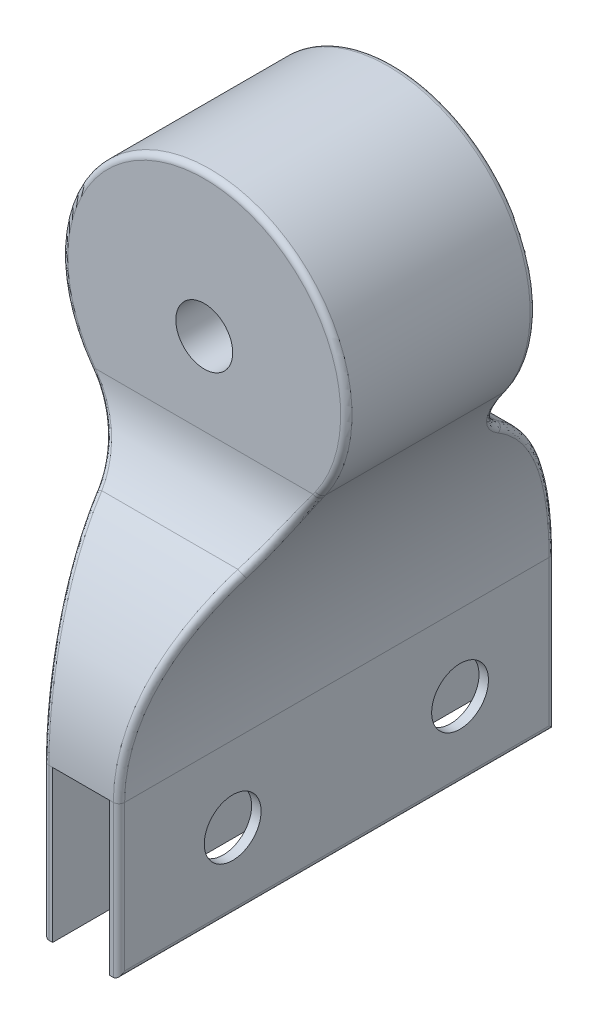
from build123d import *

# Parameters (mm, degrees)
BOSS_EXTRUDE1_DEPTH     = 23
CUT_EXTRUDE2_DEPTH      = 23
CUT_EXTRUDE2_DEPTH_BACK = 23
SKETCH2_OUTSIDE_W       = 32.388
SKETCH2_OUTSIDE_H       = 34.095
SKETCH3_W               = 0.5
SKETCH3_H               = 23
BOSS_EXTRUDE4_DEPTH     = 8
SKETCH4_R               = 1.5
CUT_EXTRUDE3_DEPTH      = 6
SKETCH5_R               = 1.5
CUT_EXTRUDE4_DEPTH      = 16
FILLET5_R               = 0.3


with BuildPart() as part:
    # Sketch1 → Boss-Extrude1 (new body)
    with BuildSketch(Plane.XY):
        with BuildLine():
            Line((-2, -17.207072189), (2, -17.207072189))
            ThreePointArc((2, -17.207072189), (3.052368374, -10.458182005), (6.109550562, -4.35010252))
            ThreePointArc((6.109550562, -4.35010252), (0, 7.5), (-6.109550562, -4.35010252))
            ThreePointArc((-6.109550562, -4.35010252), (-3.052368374, -10.458182005), (-2, -17.207072189))
        make_face()
    extrude(amount=BOSS_EXTRUDE1_DEPTH)

    # Sketch2 outside → Cut-Extrude2 (cut, two sides: drawn at the far end of the back side and taken through both)
    with BuildSketch(Plane(origin=(0, 0, 0), x_dir=(0, 0, -1), z_dir=(1, 0, 0)).offset(-CUT_EXTRUDE2_DEPTH_BACK)):
        with Locations((-11.5, -4.8535)):
            Rectangle(SKETCH2_OUTSIDE_W, SKETCH2_OUTSIDE_H)
        with BuildLine():
            Line((-16.5, 7.5), (-6.5, 7.5))
            Line((-6.5, 7.5), (-6.5, -4.35010252))
            ThreePointArc((-6.5, -4.35010252), (-6.019657091, -6.364854541), (-4.681966685, -7.946163934))
            ThreePointArc((-4.681966685, -7.946163934), (-11.5, -28.707072189), (-18.318033315, -7.946163934))
            ThreePointArc((-18.318033315, -7.946163934), (-16.980342909, -6.364854541), (-16.5, -4.35010252))
            Line((-16.5, -4.35010252), (-16.5, 7.5))
        make_face(mode=Mode.SUBTRACT)
    extrude(amount=CUT_EXTRUDE2_DEPTH + CUT_EXTRUDE2_DEPTH_BACK, mode=Mode.SUBTRACT)

    # Sketch3 → Boss-Extrude4 (add)
    with BuildSketch(Plane.XZ.offset(17.207072189)):
        with Locations((-1.75, 11.5)):
            Rectangle(SKETCH3_W, SKETCH3_H)
        with Locations((1.75, 11.5)):
            Rectangle(SKETCH3_W, SKETCH3_H)
    extrude(amount=BOSS_EXTRUDE4_DEPTH)

    # Sketch4 → Cut-Extrude3 (cut)
    with BuildSketch(Plane.ZY.offset(2)):
        with Locations((17, -21.207072189)):
            Circle(SKETCH4_R)
        with Locations((5, -21.207072189)):
            Circle(SKETCH4_R)
    extrude(amount=-CUT_EXTRUDE3_DEPTH, mode=Mode.SUBTRACT)

    # Sketch5 → Cut-Extrude4 (cut)
    with BuildSketch(Plane.XY.offset(16.5)):
        Circle(SKETCH5_R)
    extrude(amount=-CUT_EXTRUDE4_DEPTH, mode=Mode.SUBTRACT)

    # Fillet5
    fillet5_edges = [part.edges().sort_by_distance(p)[0] for p in [
        (4.879540426, -6.281511676, 6.060709176),
        (2.630286808, -11.958695915, 1.267476013),
        (2.630286808, -11.958695916, 21.732523986),
        (4.879540426, -6.281511676, 16.939290824),
        (0, 7.5, 6.5),
        (0, 7.5, 16.5),
        (-2.630286808, -11.958695915, 1.267476013),
        (-4.879540426, -6.281511676, 6.060709176),
        (-4.879540426, -6.281511676, 16.939290824),
        (-2.630286808, -11.958695916, 21.732523986),
        (2, -21.207072189, 0),
        (2, -25.207072189, 11.5),
        (2, -21.207072189, 23),
        (-2, -25.207072189, 11.5),
        (-2, -21.207072189, 23),
        (-2, -21.207072189, 0),
    ]]
    fillet(fillet5_edges, radius=FILLET5_R)


solid = part.part
